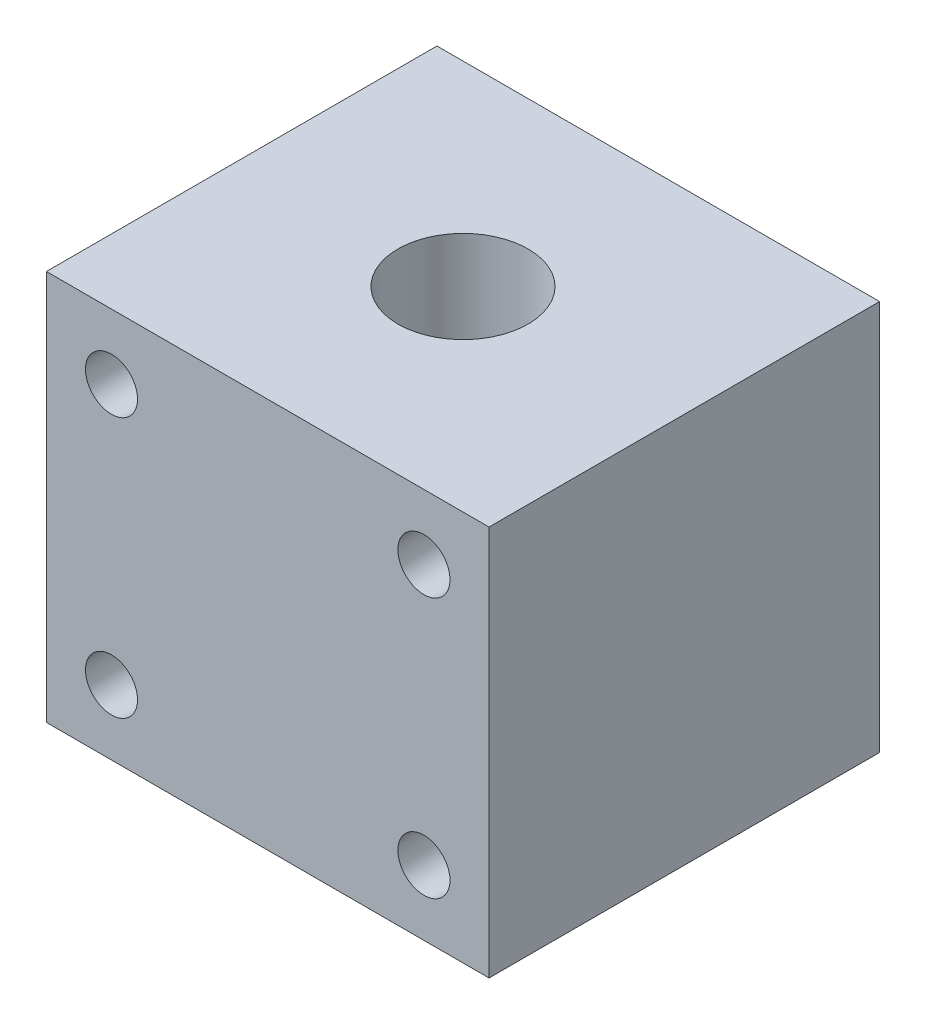
from build123d import *

# Parameters (mm, degrees)
SKETCH1_W               = 34
SKETCH1_H               = 30
SKETCH1_R               = 5
BOSS_EXTRUDE1_DEPTH     = 30
CUT_EXTRUDE1_DEPTH      = 55.369108876
CUT_EXTRUDE1_DEPTH_BACK = 55.369108876
SKETCH2_R               = 2


with BuildPart() as part:
    # Sketch1 → Boss-Extrude1 (new body)
    with BuildSketch(Plane(origin=(0, 0, 0), x_dir=(1, 0, 0), z_dir=(0, 1, 0))):
        with Locations((17, -15)):
            Rectangle(SKETCH1_W, SKETCH1_H)
        with Locations(Location((17, -15, 0), (0, 0, 270))):
            Circle(SKETCH1_R, mode=Mode.SUBTRACT)
    extrude(amount=BOSS_EXTRUDE1_DEPTH)

    # Sketch2 → Cut-Extrude1 (cut, two sides: drawn at the far end of the back side and taken through both)
    with BuildSketch(Plane(origin=(0, 0, 0), x_dir=(-1, 0, 0), z_dir=(0, 0, -1)).offset(-CUT_EXTRUDE1_DEPTH_BACK)):
        with Locations((-29, 25)):
            Circle(SKETCH2_R)
        with Locations(Location((-5, 25, 0), (0, 0, 180))):
            Circle(SKETCH2_R)
        with Locations((-5, 5)):
            Circle(SKETCH2_R)
        with Locations(Location((-29, 5, 0), (0, 0, 180))):
            Circle(SKETCH2_R)
    extrude(amount=CUT_EXTRUDE1_DEPTH + CUT_EXTRUDE1_DEPTH_BACK, mode=Mode.SUBTRACT)


solid = part.part
